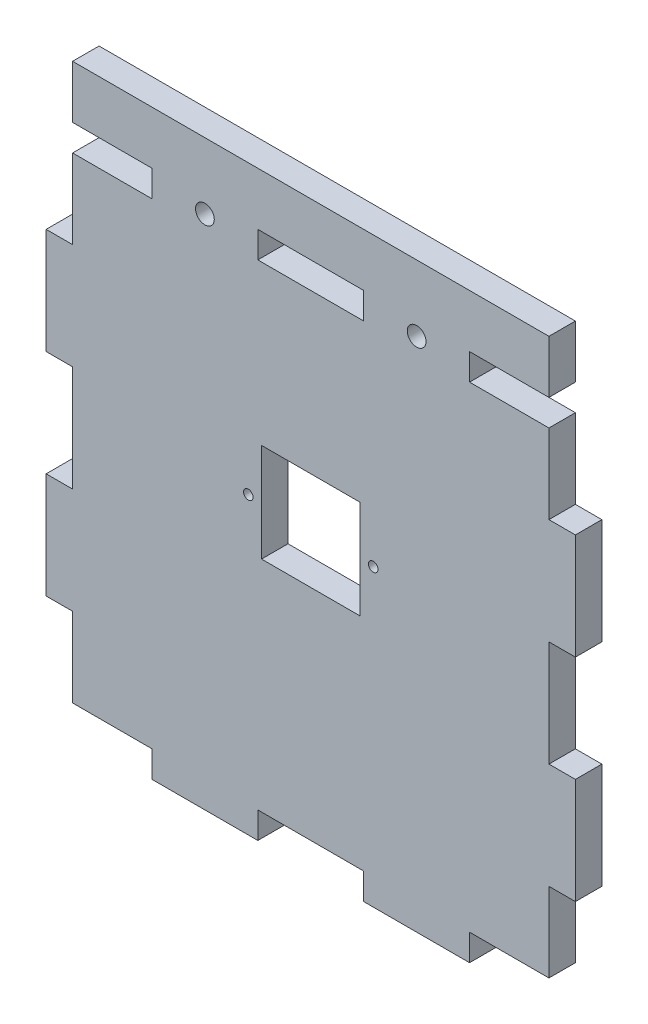
from build123d import *

# Parameters (mm, degrees)
SKETCH1_W                 = 127
SKETCH1_H                 = 139.7
BOSS_EXTRUDE1_DEPTH       = 6.35
SKETCH5_W                 = 6.35
SKETCH5_H                 = 25.4
CUT_EXTRUDE4_DEPTH        = 6.35
SKETCH6_W                 = 25.4
SKETCH6_H                 = 6.35
CUT_EXTRUDE5_DEPTH        = 6.35
LPATTERN5_COUNT           = 3
LPATTERN5_PITCH           = 50.8
LPATTERN5_COUNT_DIR2      = 2
LPATTERN5_PITCH_DIR2      = 120.65
LPATTERN6_COUNT           = 3
LPATTERN6_PITCH           = 50.8
LPATTERN6_COUNT_DIR2      = 2
LPATTERN6_PITCH_DIR2      = 120.65
SKETCH7_W                 = 6.35
SKETCH7_H                 = 19.05
CUT_EXTRUDE6_DEPTH        = 6.35
SKETCH12_W                = 6.35
SKETCH12_H                = 12.7
CUT_EXTRUDE9_DEPTH        = 7.62
F_8_CLEARANCE_HOLE1_D     = 4.4958
F_8_CLEARANCE_HOLE1_DEPTH = 10.16
F_8_CLEARANCE_HOLE1_TIP   = 1.350674586
SKETCH11_R                = 1.143
SKETCH11_W                = 23.622
SKETCH11_H                = 23.622
CUT_EXTRUDE8_DEPTH        = 7.62


with BuildPart() as part:
    # Sketch1 → Boss-Extrude1 (new body)
    with BuildSketch(Plane.XY):
        with Locations((63.5, 69.85)):
            Rectangle(SKETCH1_W, SKETCH1_H)
    extrude(amount=BOSS_EXTRUDE1_DEPTH)

    # Sketch5 → Cut-Extrude4 (cut)
    with BuildSketch(Plane.XY.offset(6.35)):
        with Locations((3.175, 12.7)):
            Rectangle(SKETCH5_W, SKETCH5_H)
    cut_extrude4 = extrude(amount=-CUT_EXTRUDE4_DEPTH, mode=Mode.SUBTRACT)

    # Sketch6 → Cut-Extrude5 (cut)
    with BuildSketch(Plane.XY.offset(6.35)):
        with Locations((12.7, 3.175)):
            Rectangle(SKETCH6_W, SKETCH6_H)
    cut_extrude5 = extrude(amount=-CUT_EXTRUDE5_DEPTH, mode=Mode.SUBTRACT)

    # LPattern5: Cut-Extrude4 3 × 2
    with Locations(*[(j * LPATTERN5_PITCH_DIR2, i * LPATTERN5_PITCH, 0) for i in range(LPATTERN5_COUNT) for j in range(LPATTERN5_COUNT_DIR2) if (i, j) != (0, 0)]):
        add(cut_extrude4, mode=Mode.SUBTRACT)

    # LPattern6: Cut-Extrude5 3 × 2
    with Locations(*[(i * LPATTERN6_PITCH, j * LPATTERN6_PITCH_DIR2, 0) for i in range(LPATTERN6_COUNT) for j in range(LPATTERN6_COUNT_DIR2) if (i, j) != (0, 0)]):
        add(cut_extrude5, mode=Mode.SUBTRACT)

    # Sketch7 → Cut-Extrude6 (cut)
    with BuildSketch(Plane.XY.offset(6.35)):
        with Locations((3.175, 130.175)):
            Rectangle(SKETCH7_W, SKETCH7_H)
    extrude(amount=-CUT_EXTRUDE6_DEPTH, mode=Mode.SUBTRACT)

    # Sketch12 → Cut-Extrude9 (cut)
    with BuildSketch(Plane.XY.offset(6.35)):
        with Locations((123.825, 133.35)):
            Rectangle(SKETCH12_W, SKETCH12_H)
    extrude(amount=-CUT_EXTRUDE9_DEPTH, mode=Mode.SUBTRACT)

    # #8 Clearance Hole1
    with Locations(Plane.XY.offset(6.35)):
        with Locations((38.1, 123.825), (88.9, 123.825)):
            Hole(F_8_CLEARANCE_HOLE1_D / 2, depth=F_8_CLEARANCE_HOLE1_DEPTH)
            with Locations((0, 0, -(F_8_CLEARANCE_HOLE1_DEPTH + F_8_CLEARANCE_HOLE1_TIP / 2))):  # 118° drill point
                Cone(0, F_8_CLEARANCE_HOLE1_D / 2, F_8_CLEARANCE_HOLE1_TIP, mode=Mode.SUBTRACT)

    # Sketch11 → Cut-Extrude8 (cut)
    with BuildSketch(Plane.XY.offset(6.35)):
        with Locations((48.514, 70.739)):
            Circle(SKETCH11_R)
        with Locations((78.486, 70.739)):
            Circle(SKETCH11_R)
        with Locations((63.5, 70.739)):
            Rectangle(SKETCH11_W, SKETCH11_H)
    extrude(amount=-CUT_EXTRUDE8_DEPTH, mode=Mode.SUBTRACT)


solid = part.part
